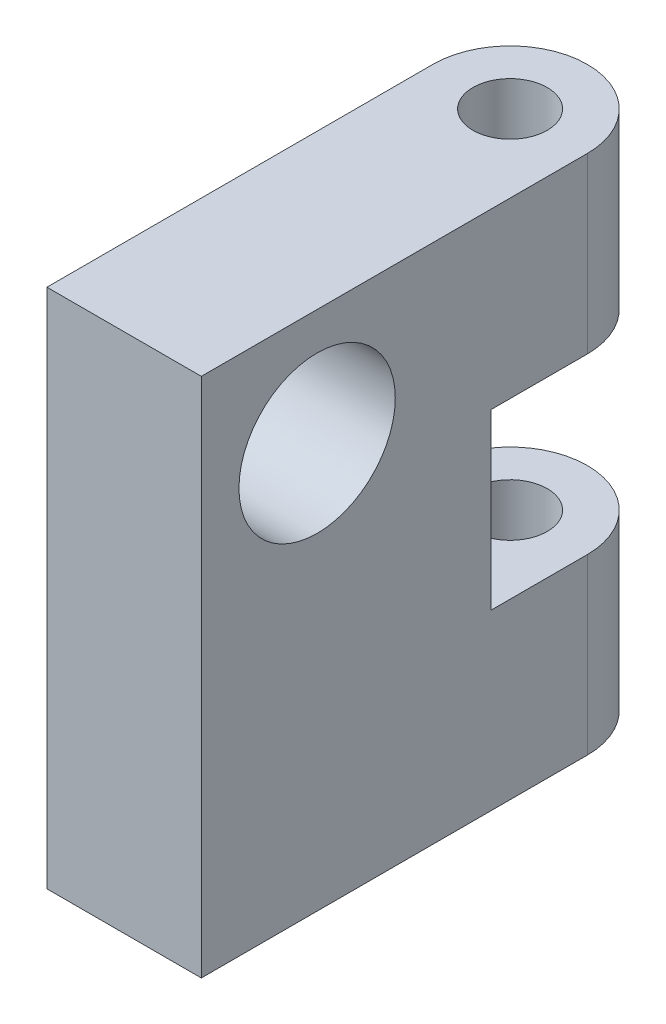
from build123d import *

# Parameters (mm, degrees)
SKETCH2_R           = 4
SKETCH2_R_2         = 1.925
BOSS_EXTRUDE1_DEPTH = 27
SKETCH3_R           = 4.05
CUT_EXTRUDE1_DEPTH  = 25
SKETCH5_W           = 9
SKETCH5_H           = 9
CUT_EXTRUDE2_DEPTH  = 25
SKETCH6_R           = 1.825
CUT_EXTRUDE3_DEPTH  = 5


with BuildPart() as part:
    # Sketch2 → Boss-Extrude1 (new body)
    # profile 1 of 2: a face of its own
    with BuildSketch(Plane(origin=(0, 0, 0), x_dir=(1, 0, 0), z_dir=(0, 1, 0))):
        Circle(SKETCH2_R)
        with Locations(Location((0, 0, 0), (0, 0, 270))):
            Circle(SKETCH2_R_2, mode=Mode.SUBTRACT)
    # profile 2 of 2: a face of its own
    with BuildSketch(Plane(origin=(0, 0, 0), x_dir=(1, 0, 0), z_dir=(0, 1, 0))):
        with BuildLine():
            ThreePointArc((4, 0), (0, -4), (-4, 0))
            Line((-4, 0), (-4, -20))
            Line((-4, -20), (4, -20))
            Line((4, -20), (4, 0))
        make_face()
    extrude(amount=BOSS_EXTRUDE1_DEPTH)

    # Sketch3 → Cut-Extrude1 (cut)
    with BuildSketch(Plane(origin=(4, 0, 0), x_dir=(0, 0, -1), z_dir=(1, 0, 0))):
        with Locations((-14, 21)):
            Circle(SKETCH3_R)
    extrude(amount=-CUT_EXTRUDE1_DEPTH, mode=Mode.SUBTRACT)

    # Sketch5 → Cut-Extrude2 (cut)
    with BuildSketch(Plane.ZY.offset(4)):
        with Locations((0.5, 13.5)):
            Rectangle(SKETCH5_W, SKETCH5_H)
    extrude(amount=-CUT_EXTRUDE2_DEPTH, mode=Mode.SUBTRACT)

    # Sketch6 → Cut-Extrude3 (cut)
    with BuildSketch(Plane(origin=(0, 0, 0), x_dir=(-1, 0, 0), z_dir=(0, -1, 0))):
        with Locations(Location((0, -15, 0), (0, 0, 90))):
            Circle(SKETCH6_R)
    extrude(amount=-CUT_EXTRUDE3_DEPTH, mode=Mode.SUBTRACT)


solid = part.part
